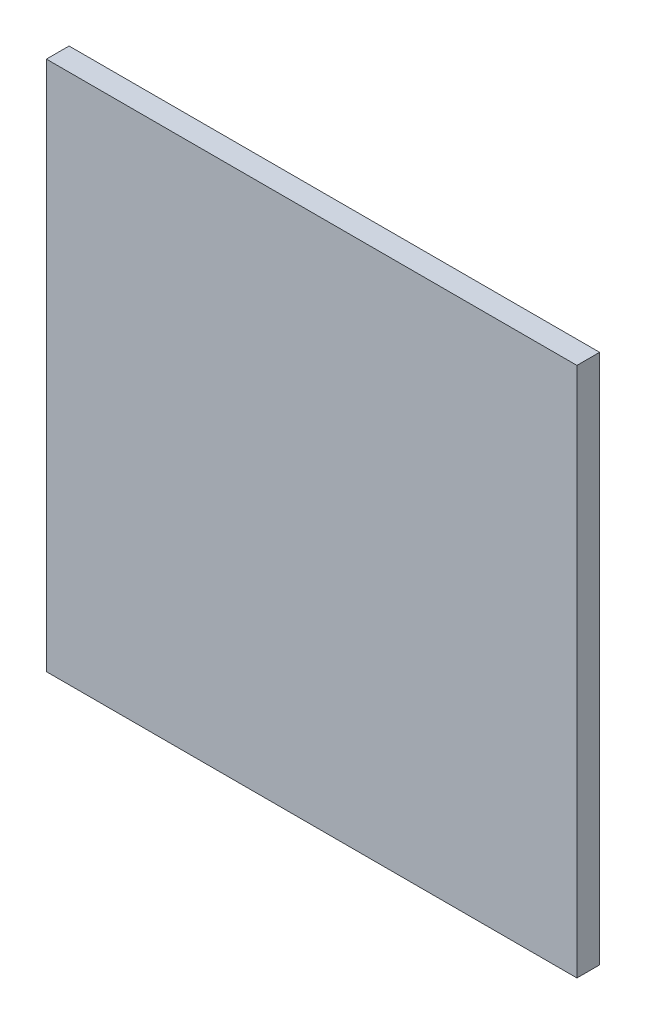
from build123d import *

# Parameters (mm, degrees)
SKETCH2_W           = 11.7
SKETCH2_H           = 11.7
BOSS_EXTRUDE1_DEPTH = 0.5


with BuildPart() as part:
    # Sketch2 → Boss-Extrude1 (new body)
    with BuildSketch(Plane.XY):
        with Locations((5.85, -5.85)):
            Rectangle(SKETCH2_W, SKETCH2_H)
    extrude(amount=BOSS_EXTRUDE1_DEPTH)


solid = part.part
